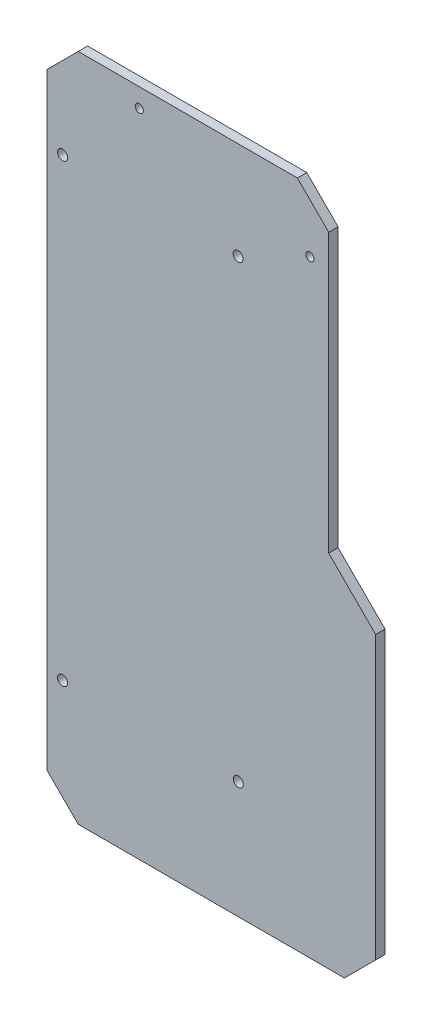
from build123d import *

# Parameters (mm, degrees)
SKETCH1_R      = 1.6
SKETCH1_R_2    = 1.3
EXTRUDE1_DEPTH = 3


with BuildPart() as part:
    # Sketch1 → Extrude1 (new body)
    with BuildSketch(Plane.XY):
        Polygon((-70, 34.003545781), (0, 34.003545781), (10, 24.003545781), (10, -64.753959847), (25, -79.753959847), (25, -169.753959847), (15, -179.753959847), (0, -179.753959847), (-70, -179.753959847), (-80, -169.753959847), (-80, 24.003545781), align=None)
        with Locations((-75, 2.893545781)):
            Circle(SKETCH1_R, mode=Mode.SUBTRACT)
        with Locations((-18.946632771, 2.893545781)):
            Circle(SKETCH1_R, mode=Mode.SUBTRACT)
        with Locations((-75, -142.403959847)):
            Circle(SKETCH1_R, mode=Mode.SUBTRACT)
        with Locations((-18.893164364, -142.403959847)):
            Circle(SKETCH1_R, mode=Mode.SUBTRACT)
        with Locations((4, 14.243545781)):
            Circle(SKETCH1_R_2, mode=Mode.SUBTRACT)
        with Locations((-50.5, 28.003545781)):
            Circle(SKETCH1_R_2, mode=Mode.SUBTRACT)
    extrude(amount=EXTRUDE1_DEPTH)


solid = part.part
